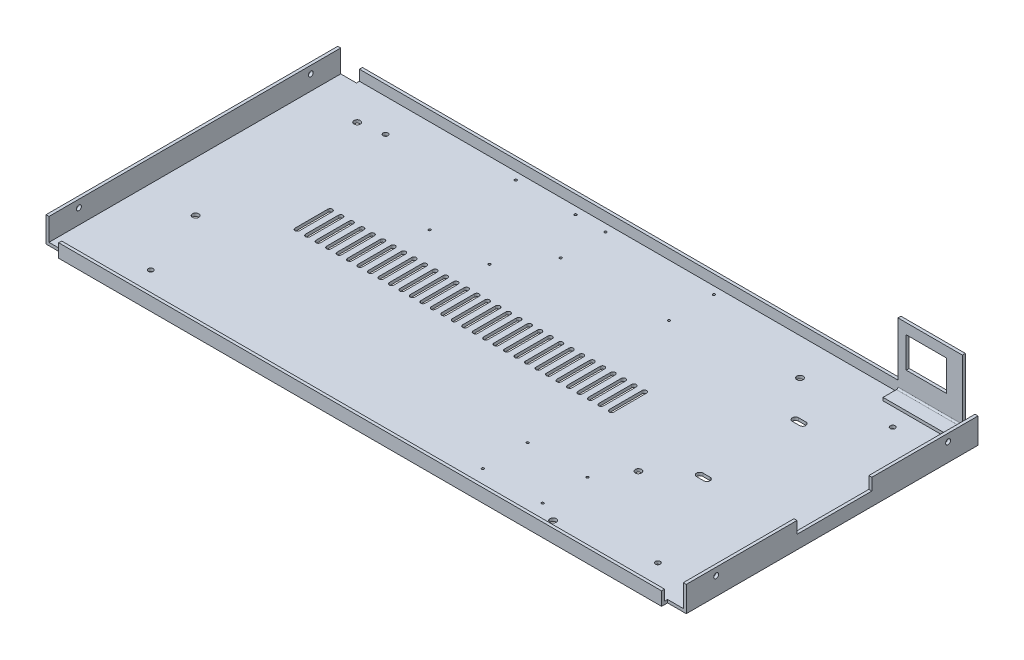
from build123d import *

# Parameters (mm, degrees)
EXTRUDE_2_DEPTH        = 2
CUT_EXTRUDE_2_DEPTH    = 237.859135353
SKETCH_5_W             = 360
SKETCH_5_H             = 2
SKETCH_5_W_2           = 403
EXTRUDE_2574_DEPTH     = 7
SKETCH_6_W             = 2
SKETCH_6_H             = 195
EXTRUDE_2807_DEPTH     = 15
CUT_EXTRUDE_3_REACH    = 442.199
SKETCH_7_W             = 50
SKETCH_7_H             = 8
EXTRUDE_5_DEPTH        = 43
HOLE_WIZARD_3528_D     = 4.2
CUT_EXTRUDE_4609_DEPTH = 241.722350437
HOLE_WIZARD_M41_D      = 3.3
HOLE_WIZARD_M42_D      = 3.3
HOLE_WIZARD_M21_D      = 1.6
CUT_EXTRUDE_4_REACH    = 300.379
SKETCH_23_W            = 27
SKETCH_23_H            = 20.5


with BuildPart() as part:
    # Эскиз1 → Бобышка-Вытянуть2 (new body)
    with BuildSketch(Plane(origin=(0, 0, 0), x_dir=(1, 0, 0), z_dir=(0, 1, 0))):
        Polygon((201.5, 101.5), (201.5, 97.5), (214, 97.5), (214, -97.5), (201.5, -97.5), (201.5, -101.5), (-201.5, -101.5), (-201.5, -97.5), (-214, -97.5), (-214, 97.5), (-201.5, 97.5), (-201.5, 101.5), align=None)
    extrude(amount=EXTRUDE_2_DEPTH)

    # Эскиз4 → Вырез-Вытянуть2 (cut, through all)
    with BuildSketch(Plane(origin=(0, 2, 0), x_dir=(1, 0, 0), z_dir=(0, 1, 0))):
        with BuildLine():
            Line((-138, 15), (-138, -7))
            ThreePointArc((-138, -7), (-136.5, -8.5), (-135, -7))
            Line((-135, -7), (-135, 15))
            ThreePointArc((-135, 15), (-136.5, 16.5), (-138, 15))
        make_face()
        with BuildLine():
            Line((-131, 15), (-131, -7))
            ThreePointArc((-131, -7), (-129.5, -8.5), (-128, -7))
            Line((-128, -7), (-128, 15))
            ThreePointArc((-128, 15), (-129.5, 16.5), (-131, 15))
        make_face()
        with BuildLine():
            Line((-124, 15), (-124, -7))
            ThreePointArc((-124, -7), (-122.5, -8.5), (-121, -7))
            Line((-121, -7), (-121, 15))
            ThreePointArc((-121, 15), (-122.5, 16.5), (-124, 15))
        make_face()
        with BuildLine():
            Line((-117, 15), (-117, -7))
            ThreePointArc((-117, -7), (-115.5, -8.5), (-114, -7))
            Line((-114, -7), (-114, 15))
            ThreePointArc((-114, 15), (-115.5, 16.5), (-117, 15))
        make_face()
        with BuildLine():
            Line((-110, 15), (-110, -7))
            ThreePointArc((-110, -7), (-108.5, -8.5), (-107, -7))
            Line((-107, -7), (-107, 15))
            ThreePointArc((-107, 15), (-108.5, 16.5), (-110, 15))
        make_face()
        with BuildLine():
            Line((-103, 15), (-103, -7))
            ThreePointArc((-103, -7), (-101.5, -8.5), (-100, -7))
            Line((-100, -7), (-100, 15))
            ThreePointArc((-100, 15), (-101.5, 16.5), (-103, 15))
        make_face()
        with BuildLine():
            Line((-96, 15), (-96, -7))
            ThreePointArc((-96, -7), (-94.5, -8.5), (-93, -7))
            Line((-93, -7), (-93, 15))
            ThreePointArc((-93, 15), (-94.5, 16.5), (-96, 15))
        make_face()
        with BuildLine():
            Line((-89, 15), (-89, -7))
            ThreePointArc((-89, -7), (-87.5, -8.5), (-86, -7))
            Line((-86, -7), (-86, 15))
            ThreePointArc((-86, 15), (-87.5, 16.5), (-89, 15))
        make_face()
        with BuildLine():
            Line((-82, 15), (-82, -7))
            ThreePointArc((-82, -7), (-80.5, -8.5), (-79, -7))
            Line((-79, -7), (-79, 15))
            ThreePointArc((-79, 15), (-80.5, 16.5), (-82, 15))
        make_face()
        with BuildLine():
            Line((-75, 15), (-75, -7))
            ThreePointArc((-75, -7), (-73.5, -8.5), (-72, -7))
            Line((-72, -7), (-72, 15))
            ThreePointArc((-72, 15), (-73.5, 16.5), (-75, 15))
        make_face()
        with BuildLine():
            Line((-68, 15), (-68, -7))
            ThreePointArc((-68, -7), (-66.5, -8.5), (-65, -7))
            Line((-65, -7), (-65, 15))
            ThreePointArc((-65, 15), (-66.5, 16.5), (-68, 15))
        make_face()
        with BuildLine():
            Line((-61, 15), (-61, -7))
            ThreePointArc((-61, -7), (-59.5, -8.5), (-58, -7))
            Line((-58, -7), (-58, 15))
            ThreePointArc((-58, 15), (-59.5, 16.5), (-61, 15))
        make_face()
        with BuildLine():
            Line((-54, 15), (-54, -7))
            ThreePointArc((-54, -7), (-52.5, -8.5), (-51, -7))
            Line((-51, -7), (-51, 15))
            ThreePointArc((-51, 15), (-52.5, 16.5), (-54, 15))
        make_face()
        with BuildLine():
            Line((-47, 15), (-47, -7))
            ThreePointArc((-47, -7), (-45.5, -8.5), (-44, -7))
            Line((-44, -7), (-44, 15))
            ThreePointArc((-44, 15), (-45.5, 16.5), (-47, 15))
        make_face()
        with BuildLine():
            Line((-40, 15), (-40, -7))
            ThreePointArc((-40, -7), (-38.5, -8.5), (-37, -7))
            Line((-37, -7), (-37, 15))
            ThreePointArc((-37, 15), (-38.5, 16.5), (-40, 15))
        make_face()
        with BuildLine():
            Line((-33, 15), (-33, -7))
            ThreePointArc((-33, -7), (-31.5, -8.5), (-30, -7))
            Line((-30, -7), (-30, 15))
            ThreePointArc((-30, 15), (-31.5, 16.5), (-33, 15))
        make_face()
        with BuildLine():
            Line((-26, 15), (-26, -7))
            ThreePointArc((-26, -7), (-24.5, -8.5), (-23, -7))
            Line((-23, -7), (-23, 15))
            ThreePointArc((-23, 15), (-24.5, 16.5), (-26, 15))
        make_face()
        with BuildLine():
            Line((-19, 15), (-19, -7))
            ThreePointArc((-19, -7), (-17.5, -8.5), (-16, -7))
            Line((-16, -7), (-16, 15))
            ThreePointArc((-16, 15), (-17.5, 16.5), (-19, 15))
        make_face()
        with BuildLine():
            Line((-12, 15), (-12, -7))
            ThreePointArc((-12, -7), (-10.5, -8.5), (-9, -7))
            Line((-9, -7), (-9, 15))
            ThreePointArc((-9, 15), (-10.5, 16.5), (-12, 15))
        make_face()
        with BuildLine():
            Line((-5, 15), (-5, -7))
            ThreePointArc((-5, -7), (-3.5, -8.5), (-2, -7))
            Line((-2, -7), (-2, 15))
            ThreePointArc((-2, 15), (-3.5, 16.5), (-5, 15))
        make_face()
        with BuildLine():
            Line((2, 15), (2, -7))
            ThreePointArc((2, -7), (3.5, -8.5), (5, -7))
            Line((5, -7), (5, 15))
            ThreePointArc((5, 15), (3.5, 16.5), (2, 15))
        make_face()
        with BuildLine():
            Line((9, 15), (9, -7))
            ThreePointArc((9, -7), (10.5, -8.5), (12, -7))
            Line((12, -7), (12, 15))
            ThreePointArc((12, 15), (10.5, 16.5), (9, 15))
        make_face()
        with BuildLine():
            Line((16, 15), (16, -7))
            ThreePointArc((16, -7), (17.5, -8.5), (19, -7))
            Line((19, -7), (19, 15))
            ThreePointArc((19, 15), (17.5, 16.5), (16, 15))
        make_face()
        with BuildLine():
            Line((23, 15), (23, -7))
            ThreePointArc((23, -7), (24.5, -8.5), (26, -7))
            Line((26, -7), (26, 15))
            ThreePointArc((26, 15), (24.5, 16.5), (23, 15))
        make_face()
        with BuildLine():
            Line((30, 15), (30, -7))
            ThreePointArc((30, -7), (31.5, -8.5), (33, -7))
            Line((33, -7), (33, 15))
            ThreePointArc((33, 15), (31.5, 16.5), (30, 15))
        make_face()
        with BuildLine():
            Line((37, 15), (37, -7))
            ThreePointArc((37, -7), (38.5, -8.5), (40, -7))
            Line((40, -7), (40, 15))
            ThreePointArc((40, 15), (38.5, 16.5), (37, 15))
        make_face()
        with BuildLine():
            Line((44, 15), (44, -7))
            ThreePointArc((44, -7), (45.5, -8.5), (47, -7))
            Line((47, -7), (47, 15))
            ThreePointArc((47, 15), (45.5, 16.5), (44, 15))
        make_face()
        with BuildLine():
            Line((51, 15), (51, -7))
            ThreePointArc((51, -7), (52.5, -8.5), (54, -7))
            Line((54, -7), (54, 15))
            ThreePointArc((54, 15), (52.5, 16.5), (51, 15))
        make_face()
        with BuildLine():
            Line((58, 15), (58, -7))
            ThreePointArc((58, -7), (59.5, -8.5), (61, -7))
            Line((61, -7), (61, 15))
            ThreePointArc((61, 15), (59.5, 16.5), (58, 15))
        make_face()
        with BuildLine():
            Line((65, 15), (65, -7))
            ThreePointArc((65, -7), (66.5, -8.5), (68, -7))
            Line((68, -7), (68, 15))
            ThreePointArc((68, 15), (66.5, 16.5), (65, 15))
        make_face()
        with BuildLine():
            Line((72, 15), (72, -7))
            ThreePointArc((72, -7), (73.5, -8.5), (75, -7))
            Line((75, -7), (75, 15))
            ThreePointArc((75, 15), (73.5, 16.5), (72, 15))
        make_face()
    extrude(amount=-CUT_EXTRUDE_2_DEPTH, mode=Mode.SUBTRACT)

    # Эскиз5 → Extrude 2574 (add)
    with BuildSketch(Plane(origin=(0, 2, 0), x_dir=(1, 0, 0), z_dir=(0, 1, 0))):
        with Locations((-21.5, 100.5)):
            Rectangle(SKETCH_5_W, SKETCH_5_H)
        with Locations((0, -100.5)):
            Rectangle(SKETCH_5_W_2, SKETCH_5_H)
    extrude(amount=EXTRUDE_2574_DEPTH)

    # Эскиз6 → Extrude 2807 (add)
    with BuildSketch(Plane(origin=(0, 2, 0), x_dir=(1, 0, 0), z_dir=(0, 1, 0))):
        with Locations((-213, 0)):
            Rectangle(SKETCH_6_W, SKETCH_6_H)
        with Locations((213, 0)):
            Rectangle(SKETCH_6_W, SKETCH_6_H)
    extrude(amount=EXTRUDE_2807_DEPTH)

    # Эскиз7 → Вырез-Вытянуть3 (cut, up to next)
    with BuildSketch(Plane(origin=(214, 0, 0), x_dir=(0, 0, -1), z_dir=(1, 0, 0)), mode=Mode.PRIVATE) as cut_extrude_3_sk1:
        with Locations((1.5, 13)):
            Rectangle(SKETCH_7_W, SKETCH_7_H)
    cut_extrude_3_tool1 = extrude(cut_extrude_3_sk1.sketch, amount=-CUT_EXTRUDE_3_REACH, mode=Mode.PRIVATE) & part.part
    add(cut_extrude_3_tool1.solids().sort_by_distance((214, 13, -1.5))[0], mode=Mode.SUBTRACT)

    # Эскиз9 → Бобышка-Вытянуть5 (add)
    with BuildSketch(Plane(origin=(158.5, 0, 0), x_dir=(0, 0, -1), z_dir=(1, 0, 0))):
        with BuildLine():
            Line((100, 2), (89.5, 2))
            Line((89.5, 2), (89.5, 4))
            Line((89.5, 4), (98.5, 4))
            ThreePointArc((98.5, 4), (99.207106781, 4.292893219), (99.5, 5))
            Line((99.5, 5), (99.5, 45))
            Line((99.5, 45), (101.5, 45))
            Line((101.5, 45), (101.5, 3.5))
            ThreePointArc((101.5, 3.5), (101.060660172, 2.439339828), (100, 2))
        make_face()
    extrude(amount=EXTRUDE_5_DEPTH)

    # Hole Wizard 3528 (through all)
    with Locations(Plane(origin=(0, 2, 0), x_dir=(1, 0, 0), z_dir=(0, 1, 0))):
        with Locations((-178.5, 75), (-178.5, -33), (117.5, -33), (117.5, -90), (117.5, 75)):
            Hole(HOLE_WIZARD_3528_D / 2)

    # Эскиз13 → Cut-Extrude 4609 (cut, through all)
    with BuildSketch(Plane(origin=(0, 2, 0), x_dir=(1, 0, 0), z_dir=(0, 1, 0))):
        with BuildLine():
            Line((140.1, 51.5), (144.9, 51.5))
            ThreePointArc((144.9, 51.5), (147, 49.4), (144.9, 47.3))
            Line((144.9, 47.3), (140.1, 47.3))
            ThreePointArc((140.1, 47.3), (138, 49.4), (140.1, 51.5))
        make_face()
        with BuildLine():
            Line((140.1, -12.5), (144.9, -12.5))
            ThreePointArc((144.9, -12.5), (147, -14.6), (144.9, -16.7))
            Line((144.9, -16.7), (140.1, -16.7))
            ThreePointArc((140.1, -16.7), (138, -14.6), (140.1, -12.5))
        make_face()
    extrude(amount=-CUT_EXTRUDE_4609_DEPTH, mode=Mode.SUBTRACT)

    # Отверстие обработанное метчиком M41 (through all)
    with Locations(Plane(origin=(214, 0, 0), x_dir=(0, 0, -1), z_dir=(1, 0, 0))):
        with Locations((77.5, 12), (-77.5, 12)):
            Hole(HOLE_WIZARD_M41_D / 2)

    # Отверстие обработанное метчиком M42 (through all)
    with Locations(Plane(origin=(0, 0, 0), x_dir=(-1, 0, 0), z_dir=(0, -1, 0))):
        with Locations((-177, 77.5), (-177, -79.5), (162, -79.5), (162, 77.5)):
            Hole(HOLE_WIZARD_M42_D / 2)

    # Отверстие обработанное метчиком M21 (through all)
    with Locations(Plane(origin=(0, 2, 0), x_dir=(1, 0, 0), z_dir=(0, 1, 0))):
        with Locations((-92, 94.5), (-52, 94.5), (-52, 37), (-92, 37), (-32, 64.5), (-32, 94.5), (40.5, 94.5), (40.5, 64.5), (64, -53.5), (64, -83.5), (104, -83.5), (104, -53.5)):
            Hole(HOLE_WIZARD_M21_D / 2)

    # Эскиз23 → Вырез-Вытянуть4 (cut, up to next)
    with BuildSketch(Plane(origin=(0, 0, -101.5), x_dir=(-1, 0, 0), z_dir=(0, 0, -1)), mode=Mode.PRIVATE) as cut_extrude_4_sk1:
        with Locations((-177.5, 27.75)):
            Rectangle(SKETCH_23_W, SKETCH_23_H)
    cut_extrude_4_tool1 = extrude(cut_extrude_4_sk1.sketch, amount=-CUT_EXTRUDE_4_REACH, mode=Mode.PRIVATE) & part.part
    add(cut_extrude_4_tool1.solids().sort_by_distance((177.5, 27.75, -101.5))[0], mode=Mode.SUBTRACT)


solid = part.part
